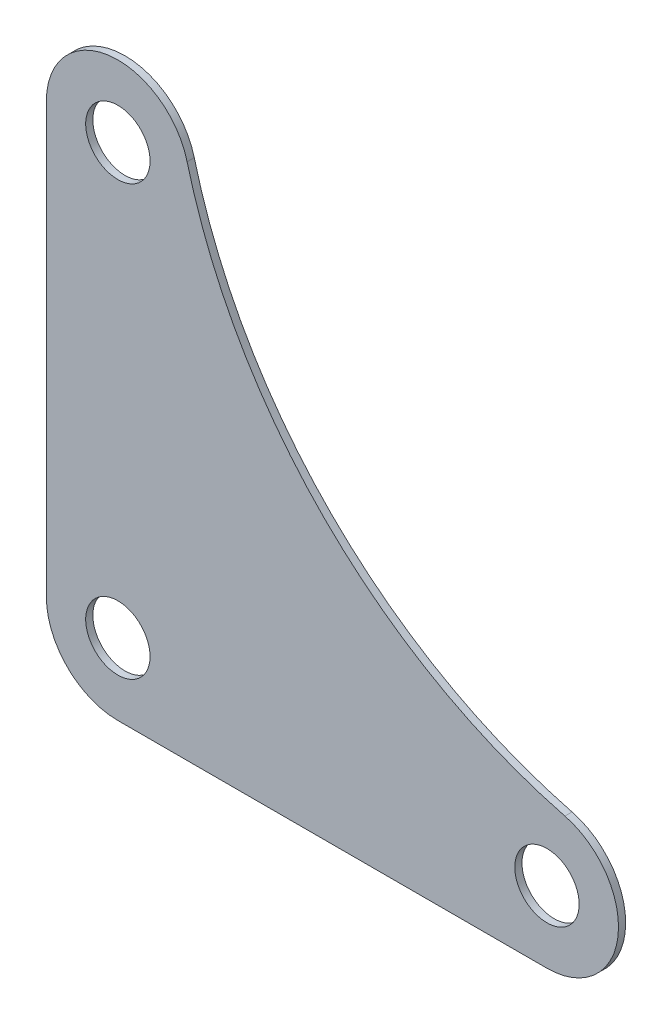
from build123d import *

# Parameters (mm, degrees)
BOSS_EXTRUDE1_DEPTH = 1
FILLET1_R           = 10
SKETCH2_R           = 4.5
CUT_EXTRUDE1_DEPTH  = 10


with BuildPart() as part:
    # Sketch1 → Boss-Extrude1 (new body)
    with BuildSketch(Plane.XY):
        with BuildLine():
            Line((0, 0), (70, 0))
            ThreePointArc((70, 0), (79.920098672, 8.738396919), (72.50304541, 19.681671533))
            ThreePointArc((72.50304541, 19.681671533), (38.890872965, 38.890872965), (19.681671533, 72.50304541))
            ThreePointArc((19.681671533, 72.50304541), (8.738396919, 79.920098672), (0, 70))
            Line((0, 70), (0, 0))
        make_face()
    extrude(amount=BOSS_EXTRUDE1_DEPTH)

    # Fillet1
    fillet1_edges = [part.edges().sort_by_distance(p)[0] for p in [
        (0, 0, 0.5),
    ]]
    fillet(fillet1_edges, radius=FILLET1_R)

    # Sketch2 → Cut-Extrude1 (cut)
    with BuildSketch(Plane.XY.offset(1)):
        with Locations((10, 10)):
            Circle(SKETCH2_R)
        with Locations((70, 10)):
            Circle(SKETCH2_R)
        with Locations((10, 70)):
            Circle(SKETCH2_R)
    extrude(amount=-CUT_EXTRUDE1_DEPTH, mode=Mode.SUBTRACT)


solid = part.part
